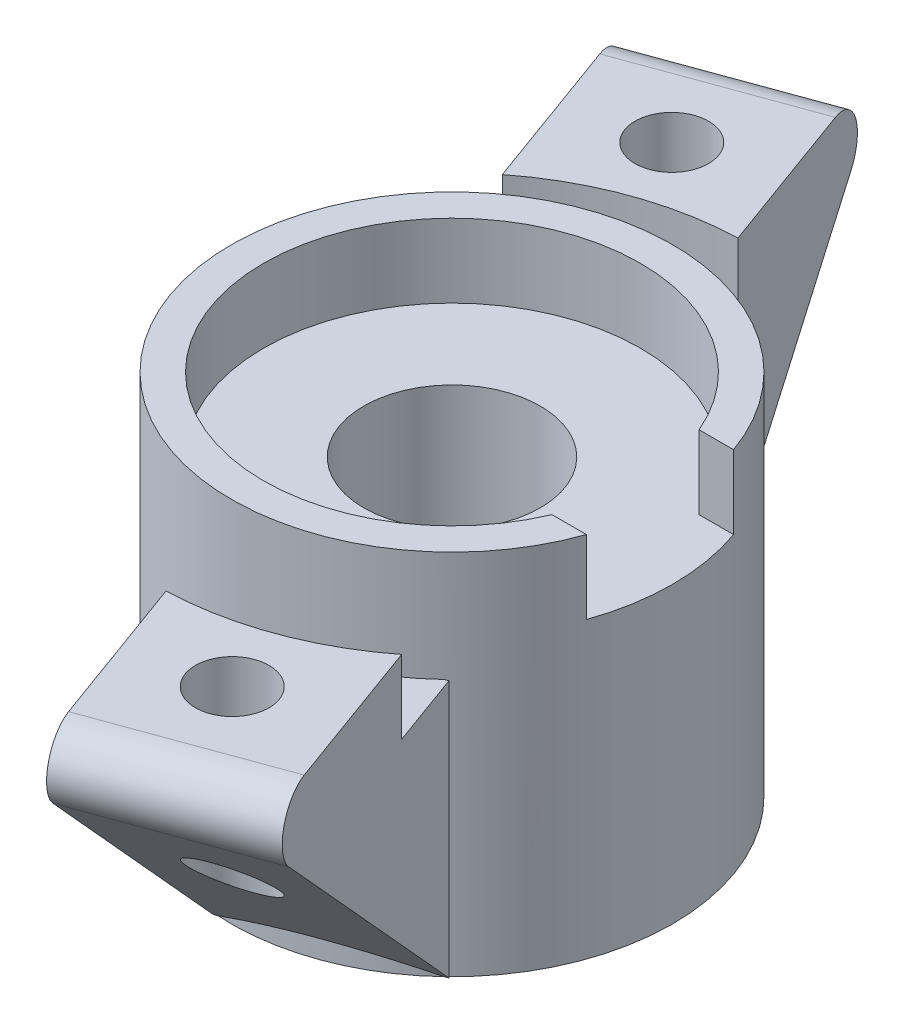
from build123d import *

# Parameters (mm, degrees)
SKETCH1_R            = 12
SKETCH1_R_2          = 4.8
BOSS_EXTRUDE2_DEPTH  = 20
SKETCH1_3_R          = 4.8
CUT_EXTRUDE2_DEPTH   = 27.229754097
SKETCH3_R            = 10.25
CUT_EXTRUDE3_DEPTH   = 4
SKETCH5_W            = 11.035067707
SKETCH5_H            = 8
CUT_EXTRUDE5_DEPTH   = 4
BOSS_EXTRUDE3_DEPTH  = 5
SKETCH7_R            = 16.1
SKETCH7_R_2          = 12
CUT_EXTRUDE6_DEPTH   = 6
CUT_EXTRUDE7_REACH   = 39.1
SKETCH9_R            = 2
FILLET1_R            = 2
FILLET1_OF_MIRROR1_R = 2


with BuildPart() as part:
    # Sketch1 → Boss-Extrude2 (new body)
    # profile 1 of 2: a face of its own
    with BuildSketch(Plane(origin=(0, 0, 0), x_dir=(1, 0, 0), z_dir=(0, 1, 0))):
        with Locations(Location((0, 0, 0), (0, 0, 270))):
            Circle(SKETCH1_R)
        Circle(SKETCH1_R_2, mode=Mode.SUBTRACT)
    # profile 2 of 2: a face of its own
    with BuildSketch(Plane(origin=(0, 0, 0), x_dir=(1, 0, 0), z_dir=(0, 1, 0))):
        Circle(SKETCH1_R_2)
    extrude(amount=-BOSS_EXTRUDE2_DEPTH)

    # Sketch1<3> → Cut-Extrude2 (cut, through all)
    with BuildSketch(Plane(origin=(0, 0, 0), x_dir=(1, 0, 0), z_dir=(0, 1, 0))):
        with Locations(Location((0, 0, 0), (0, 0, 270))):
            Circle(SKETCH1_3_R)
    extrude(amount=-CUT_EXTRUDE2_DEPTH, mode=Mode.SUBTRACT)

    # Sketch3 → Cut-Extrude3 (cut)
    with BuildSketch(Plane(origin=(0, 0, 0), x_dir=(1, 0, 0), z_dir=(0, 1, 0))):
        with Locations(Location((0, 0, 0), (0, 0, 270))):
            Circle(SKETCH3_R)
    extrude(amount=-CUT_EXTRUDE3_DEPTH, mode=Mode.SUBTRACT)

    # Sketch5 → Cut-Extrude5 (cut)
    with BuildSketch(Plane(origin=(0, 0, 0), x_dir=(1, 0, 0), z_dir=(0, 1, 0))):
        with Locations((10.966087066, 0)):
            Rectangle(SKETCH5_W, SKETCH5_H)
    extrude(amount=-CUT_EXTRUDE5_DEPTH, mode=Mode.SUBTRACT)

    # Sketch6 → Boss-Extrude3 (add, symmetric)
    with BuildSketch(Plane(origin=(0, 0, 0), x_dir=(0, -1, 0), z_dir=(-0.9396926207859094, 0, 0.34202014332566616))):
        Polygon((2, -11), (20, -11), (2, -29), align=None)
    boss_extrude3 = extrude(amount=BOSS_EXTRUDE3_DEPTH, both=True)

    # Sketch7 → Cut-Extrude6 (cut)
    with BuildSketch(Plane(origin=(0, 0, 0), x_dir=(1, 0, 0), z_dir=(0, 1, 0))):
        Circle(SKETCH7_R)
        with Locations(Location((0, 0, 0), (0, 0, 340.528779366))):
            Circle(SKETCH7_R_2, mode=Mode.SUBTRACT)
    cut_extrude6 = extrude(amount=-CUT_EXTRUDE6_DEPTH, mode=Mode.SUBTRACT)

    # Cut-Extrude7: up to this plane
    cut_extrude7_end = Plane(origin=(0.936241527, -20, -12.046719545), z_dir=(-0.2418447626479747, -0.7071067811865439, -0.664463024388679))
    # Sketch9 → Cut-Extrude7 (cut, up to the surface)
    with BuildSketch(Plane(origin=(0, -2, 0), x_dir=(1, 0, 0), z_dir=(0, 1, 0)), mode=Mode.PRIVATE) as cut_extrude7_sk1:
        with Locations(Location((-6.840402867, 18.793852416, 0), (0, 0, 270))):
            Circle(SKETCH9_R)
    cut_extrude7_tool1 = split(extrude(cut_extrude7_sk1.sketch, amount=-CUT_EXTRUDE7_REACH, mode=Mode.PRIVATE), bisect_by=cut_extrude7_end, keep=Keep.BOTH, mode=Mode.PRIVATE)
    cut_extrude7 = cut_extrude7_tool1.solids().sort_by_distance((-6.840403, -2, -18.793852))[0]
    add(cut_extrude7, mode=Mode.SUBTRACT)

    # Fillet1
    fillet1_edges = [part.edges().sort_by_distance(p)[0] for p in [
        (-9.918584156, -2, -27.251086003),
    ]]
    fillet(fillet1_edges, radius=FILLET1_R)

    # Mirror1: Boss-Extrude3, Cut-Extrude6, Cut-Extrude7 across plane
    add(boss_extrude3.mirror(Plane(origin=(0, 0, 0), x_dir=(0.9396926207859094, 0, -0.3420201433256661), z_dir=(-0.3420201433256661, 0, -0.9396926207859093))))
    add(cut_extrude6.mirror(Plane(origin=(0, 0, 0), x_dir=(0.9396926207859094, 0, -0.3420201433256661), z_dir=(-0.3420201433256661, 0, -0.9396926207859093))), mode=Mode.SUBTRACT)
    add(cut_extrude7.mirror(Plane(origin=(0, 0, 0), x_dir=(0.9396926207859094, 0, -0.3420201433256661), z_dir=(-0.3420201433256661, 0, -0.9396926207859093))), mode=Mode.SUBTRACT)

    # Fillet1 of Mirror1
    fillet1_of_mirror1_edges = [part.edges().sort_by_distance(p)[0] for p in [
        (9.918584156, -2, 27.251086003),
    ]]
    fillet(fillet1_of_mirror1_edges, radius=FILLET1_OF_MIRROR1_R)


solid = part.part
